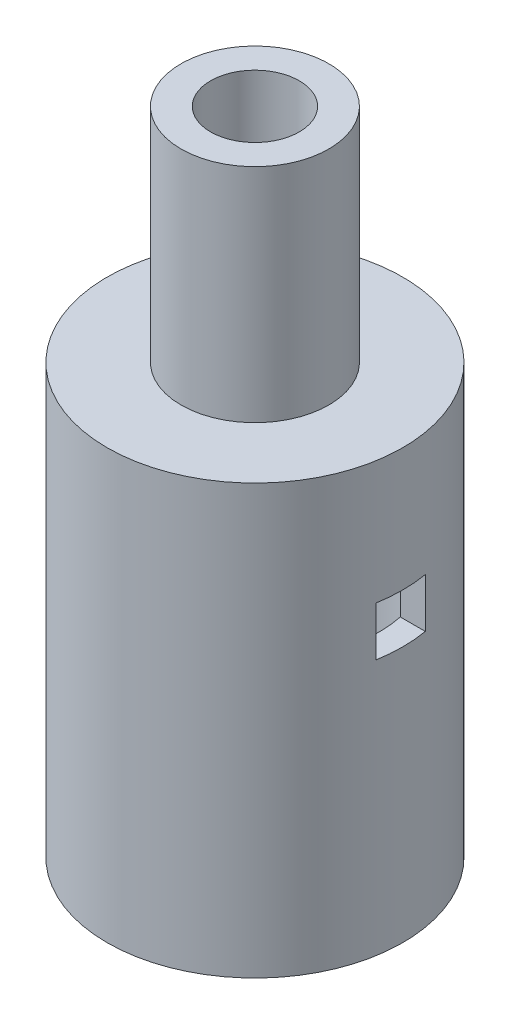
from build123d import *

# Parameters (mm, degrees)
SKETCH2_R                = 7.62
BOSS_EXTRUDE1_DEPTH      = 22.098
SKETCH3_R                = 6.35
CUT_EXTRUDE1_DEPTH       = 16.764
CUT_EXTRUDE3_DEPTH       = 16.764
CUT_EXTRUDE3_DEPTH_BACK  = 25.585573087
SKETCH5_R                = 2.3495
SKETCH6_R                = 3.81
BOSS_EXTRUDE2_DEPTH      = 11.43
SKETCH8_R                = 2.286
CUT_EXTRUDE4_DEPTH       = 11.176
CUT_EXTRUDE8_REACH       = 26.586
SKETCH10_R               = 1.719833609
CUT_EXTRUDE10_DEPTH      = 25.585573087
CUT_EXTRUDE10_DEPTH_BACK = 25.585573087
SKETCH12_W               = 2.54
SKETCH12_H               = 2.54


with BuildPart() as part:
    # Sketch2 → Boss-Extrude1 (new body)
    with BuildSketch(Plane(origin=(0, 0, 0), x_dir=(1, 0, 0), z_dir=(0, 1, 0))):
        with Locations(Location((0, 0, 0), (0, 0, 270))):
            Circle(SKETCH2_R)
    extrude(amount=-BOSS_EXTRUDE1_DEPTH)

    # Sketch3 → Cut-Extrude1 (cut)
    with BuildSketch(Plane.XZ.offset(22.098)):
        with Locations(Location((0, 0, 0), (0, 0, 270))):
            Circle(SKETCH3_R)
    extrude(amount=-CUT_EXTRUDE1_DEPTH, mode=Mode.SUBTRACT)

    # Sketch5 → Cut-Extrude3 (cut, two sides: drawn at the far end of the back side and taken through both)
    with BuildSketch(Plane(origin=(0, 0, 0), x_dir=(1, 0, 0), z_dir=(0, 1, 0)).offset(-CUT_EXTRUDE3_DEPTH_BACK)):
        with Locations(Location((0, 0, 0), (0, 0, 270))):
            Circle(SKETCH5_R)
    extrude(amount=CUT_EXTRUDE3_DEPTH + CUT_EXTRUDE3_DEPTH_BACK, mode=Mode.SUBTRACT)

    # Sketch6 → Boss-Extrude2 (add)
    with BuildSketch(Plane(origin=(0, 0, 0), x_dir=(1, 0, 0), z_dir=(0, 1, 0))):
        with Locations(Location((0, 0, 0), (0, 0, 270))):
            Circle(SKETCH6_R)
    extrude(amount=BOSS_EXTRUDE2_DEPTH)

    # Sketch8 → Cut-Extrude4 (cut)
    with BuildSketch(Plane(origin=(0, 11.43, 0), x_dir=(1, 0, 0), z_dir=(0, 1, 0))):
        with Locations(Location((0, 0, 0), (0, 0, 270))):
            Circle(SKETCH8_R)
    extrude(amount=-CUT_EXTRUDE4_DEPTH, mode=Mode.SUBTRACT)

    # Sketch10 → Cut-Extrude8 (cut, up to next)
    with BuildSketch(Plane.XZ, mode=Mode.PRIVATE) as cut_extrude8_sk1:
        with Locations(Location((0, 0, 0), (0, 0, 270))):
            Circle(SKETCH10_R)
    cut_extrude8_tool1 = extrude(cut_extrude8_sk1.sketch, amount=-CUT_EXTRUDE8_REACH, mode=Mode.PRIVATE) & part.part
    add(cut_extrude8_tool1.solids().sort_by_distance((0, 0, 0))[0], mode=Mode.SUBTRACT)

    # Sketch12 → Cut-Extrude10 (cut, two sides: drawn at the far end of the back side and taken through both)
    with BuildSketch(Plane(origin=(0, 0, 0), x_dir=(0, 0, -1), z_dir=(1, 0, 0)).offset(-CUT_EXTRUDE10_DEPTH_BACK)):
        with Locations((0, -7.62)):
            Rectangle(SKETCH12_W, SKETCH12_H)
    extrude(amount=CUT_EXTRUDE10_DEPTH + CUT_EXTRUDE10_DEPTH_BACK, mode=Mode.SUBTRACT)


solid = part.part
